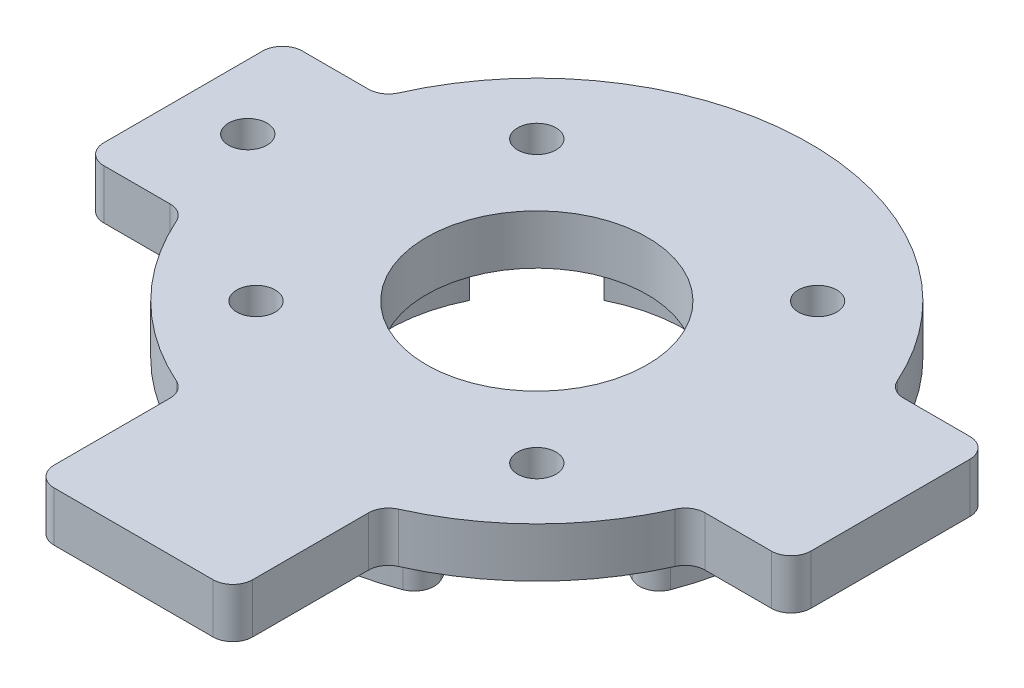
from build123d import *

# Parameters (mm, degrees)
SKETCH1_R                    = 14.12875
STOCK_EXTRUDE_DEPTH          = 6.35
F_10_0_1935_DIAMETER_HOLE1_D = 4.9149
BOSS_EXTRUDE2_DEPTH          = 6.35
FILLET2_R                    = 2.54
FILLET3_R                    = 0.254
FILLET4_R                    = 2.54
F_10_0_1935_DIAMETER_HOLE2_D = 4.9149


with BuildPart() as part:
    # Sketch1 → Stock Extrude (new body)
    # profile 1 of 6: a face of its own
    with BuildSketch(Plane(origin=(0, 0, 0), x_dir=(1, 0, 0), z_dir=(0, 1, 0))):
        with BuildLine():
            Line((-45.234068682, -12.7), (-32.534068682, -12.7))
            ThreePointArc((-32.534068682, -12.7), (-34.925, 0), (-32.534068682, 12.7))
            Line((-32.534068682, 12.7), (-45.234068682, 12.7))
            Line((-45.234068682, 12.7), (-45.234068682, -12.7))
        make_face()
    # profile 2 of 6: a face of its own
    with BuildSketch(Plane(origin=(0, 0, 0), x_dir=(1, 0, 0), z_dir=(0, 1, 0))):
        with BuildLine():
            Line((-12.7, -32.534068682), (12.7, -32.534068682))
            ThreePointArc((12.7, -32.534068682), (24.695704333, -24.695704333), (32.534068682, -12.7))
            ThreePointArc((32.534068682, -12.7), (34.322062684, -6.461550754), (34.925, 0))
            ThreePointArc((34.925, 0), (34.322062684, 6.461550754), (32.534068682, 12.7))
            ThreePointArc((32.534068682, 12.7), (0, 34.925), (-32.534068682, 12.7))
            Line((-32.534068682, 12.7), (-32.534068682, -12.7))
            ThreePointArc((-32.534068682, -12.7), (-24.695704333, -24.695704333), (-12.7, -32.534068682))
        make_face()
        with Locations(Location((0, 0, 0), (0, 0, 270))):
            Circle(SKETCH1_R, mode=Mode.SUBTRACT)
    # profile 3 of 6: a face of its own
    with BuildSketch(Plane(origin=(0, 0, 0), x_dir=(1, 0, 0), z_dir=(0, 1, 0))):
        with BuildLine():
            ThreePointArc((34.925, 0), (34.322062684, -6.461550754), (32.534068682, -12.7))
            Line((32.534068682, -12.7), (45.234068682, -12.7))
            Line((45.234068682, -12.7), (45.234068682, 12.7))
            Line((45.234068682, 12.7), (32.534068682, 12.7))
            ThreePointArc((32.534068682, 12.7), (34.322062684, 6.461550754), (34.925, 0))
        make_face()
    # profile 4 of 6: a face of its own
    with BuildSketch(Plane(origin=(0, 0, 0), x_dir=(1, 0, 0), z_dir=(0, 1, 0))):
        with BuildLine():
            ThreePointArc((-32.534068682, 12.7), (-34.925, 0), (-32.534068682, -12.7))
            Line((-32.534068682, -12.7), (-32.534068682, 12.7))
        make_face()
    # profile 5 of 6: a face of its own
    with BuildSketch(Plane(origin=(0, 0, 0), x_dir=(1, 0, 0), z_dir=(0, 1, 0))):
        with BuildLine():
            Line((-12.7, -51.584068682), (12.7, -51.584068682))
            Line((12.7, -51.584068682), (12.7, -32.534068682))
            ThreePointArc((12.7, -32.534068682), (0, -34.925), (-12.7, -32.534068682))
            Line((-12.7, -32.534068682), (-12.7, -51.584068682))
        make_face()
    # profile 6 of 6: a face of its own
    with BuildSketch(Plane(origin=(0, 0, 0), x_dir=(1, 0, 0), z_dir=(0, 1, 0))):
        with BuildLine():
            ThreePointArc((-12.7, -32.534068682), (0, -34.925), (12.7, -32.534068682))
            Line((12.7, -32.534068682), (-12.7, -32.534068682))
        make_face()
    extrude(amount=STOCK_EXTRUDE_DEPTH)

    # #10 (0.1935) Diameter Hole1 (through all)
    with Locations(Plane(origin=(0, 6.35, 0), x_dir=(1, 0, 0), z_dir=(0, 1, 0))):
        with Locations((-17.960512242, 17.960512242), (17.960512242, 17.960512242), (-17.960512242, -17.960512242), (17.960512242, -17.960512242)):
            Hole(F_10_0_1935_DIAMETER_HOLE1_D / 2)

    # Sketch4 → Boss-Extrude2 (add)
    with BuildSketch(Plane.XZ):
        with BuildLine():
            ThreePointArc((-26.735172091, 13.264787909), (-29.845, 0), (-26.735172091, -13.264787909))
            Line((-26.735172091, -13.264787909), (-17.065003462, -8.466885899))
            ThreePointArc((-17.065003462, -8.466885899), (-19.05, 0), (-17.065003462, 8.466885899))
            Line((-17.065003462, 8.466885899), (-26.735172091, 13.264787909))
        make_face()
        with BuildLine():
            Line((26.735172091, 13.264787909), (17.065003462, 8.466885899))
            ThreePointArc((17.065003462, 8.466885899), (18.547113198, 4.348228607), (19.05, 0))
            ThreePointArc((19.05, 0), (18.547113198, -4.348228607), (17.065003462, -8.466885899))
            Line((17.065003462, -8.466885899), (26.735172091, -13.264787909))
            ThreePointArc((26.735172091, -13.264787909), (29.05714401, -6.812224818), (29.845, 0))
            ThreePointArc((29.845, 0), (29.05714401, 6.812224818), (26.735172091, 13.264787909))
        make_face()
        with BuildLine():
            Line((-8.466885899, -17.065003462), (-13.264787909, -26.735172091))
            ThreePointArc((-13.264787909, -26.735172091), (0, -29.845), (13.264787909, -26.735172091))
            Line((13.264787909, -26.735172091), (8.466885899, -17.065003462))
            ThreePointArc((8.466885899, -17.065003462), (0, -19.05), (-8.466885899, -17.065003462))
        make_face()
        with BuildLine():
            ThreePointArc((13.264787909, 26.735172091), (0, 29.845), (-13.264787909, 26.735172091))
            Line((-13.264787909, 26.735172091), (-8.466885899, 17.065003462))
            ThreePointArc((-8.466885899, 17.065003462), (0, 19.05), (8.466885899, 17.065003462))
            Line((8.466885899, 17.065003462), (13.264787909, 26.735172091))
        make_face()
    extrude(amount=BOSS_EXTRUDE2_DEPTH)

    # Fillet2
    fillet2_edges = [part.edges().sort_by_distance(p)[0] for p in [
        (-26.735172091, -3.175, 13.264787909),
        (-26.735172091, -3.175, -13.264787909),
        (13.264787909, -3.175, 26.735172091),
        (-13.264787909, -3.175, 26.735172091),
        (26.735172091, -3.175, -13.264787909),
        (26.735172091, -3.175, 13.264787909),
        (-13.264787909, -3.175, -26.735172091),
        (13.264787909, -3.175, -26.735172091),
    ]]
    fillet(fillet2_edges, radius=FILLET2_R)

    # Fillet3
    fillet3_edges = [part.edges().sort_by_distance(p)[0] for p in [
        (-20.709391169, 0, -10.275066892),
        (-29.845, 0, 0),
        (0, 0, 29.845),
        (29.845, 0, 0),
        (20.70939117, 0, -10.275066892),
        (0, 0, -29.845),
        (-10.275066892, 0, -20.709391169),
        (10.275066892, 0, -20.709391169),
        (-26.404539016, 0, -12.174727831),
        (-26.404539016, 0, 12.174727831),
        (-12.174727831, 0, 26.404539016),
        (12.174727831, 0, 26.404539016),
        (26.404539016, 0, 12.174727831),
        (26.404539016, 0, -12.174727831),
        (-12.174727831, 0, -26.404539016),
        (12.174727831, 0, -26.404539016),
        (-20.709391169, 0, 10.275066892),
        (10.275066892, 0, 20.70939117),
        (-10.275066892, 0, 20.70939117),
        (20.70939117, 0, 10.275066892),
    ]]
    fillet(fillet3_edges, radius=FILLET3_R)

    # Fillet4
    fillet4_edges = [part.edges().sort_by_distance(p)[0] for p in [
        (-45.234068682, 3.175, 12.7),
        (-45.234068682, 3.175, -12.7),
        (-32.534068682, 3.175, -12.7),
        (32.534068682, 3.175, -12.7),
        (45.234068682, 3.175, -12.7),
        (45.234068682, 3.175, 12.7),
        (32.534068682, 3.175, 12.7),
        (12.7, 3.175, 32.534068682),
        (12.7, 3.175, 51.584068682),
        (-12.7, 3.175, 51.584068682),
        (-12.7, 3.175, 32.534068682),
        (-32.534068682, 3.175, 12.7),
    ]]
    fillet(fillet4_edges, radius=FILLET4_R)

    # #10 (0.1935) Diameter Hole2 (through all)
    with Locations(Plane(origin=(0, 6.35, 0), x_dir=(1, 0, 0), z_dir=(0, 1, 0))):
        with Locations((-36.979068682, 0)):
            Hole(F_10_0_1935_DIAMETER_HOLE2_D / 2)


solid = part.part
